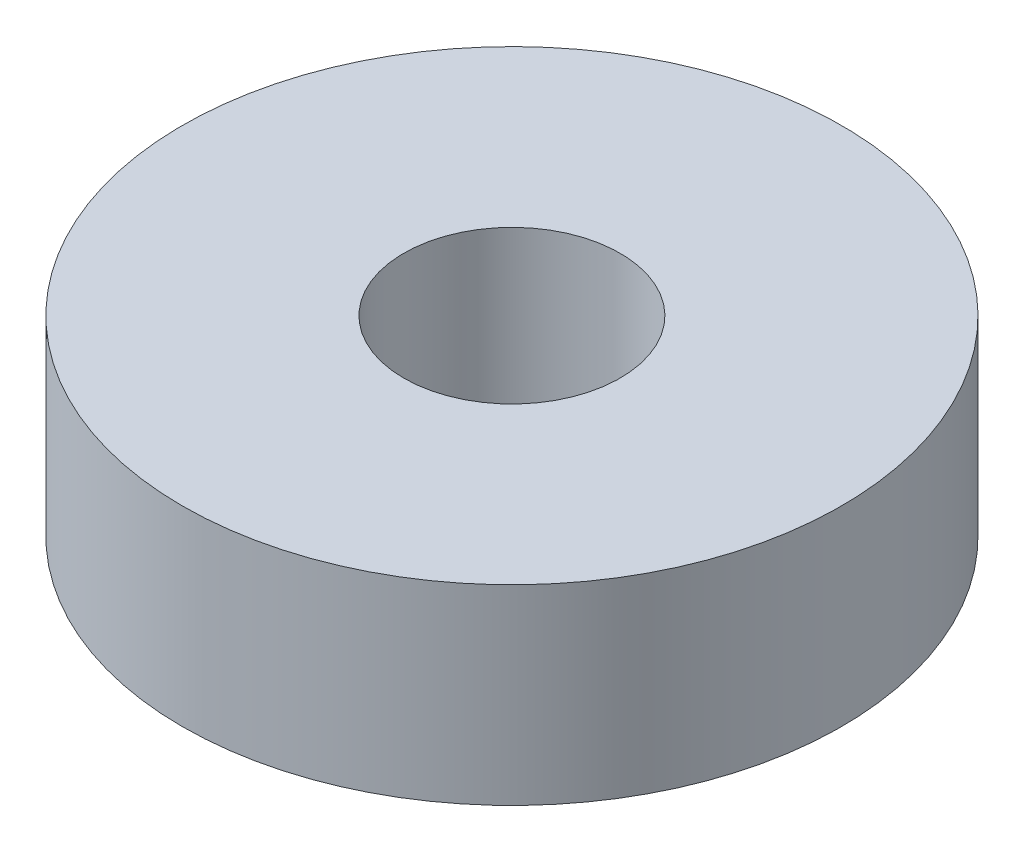
from build123d import *

# Parameters (mm, degrees)
SKETCH1_R           = 15
SKETCH1_R_2         = 4.925
BOSS_EXTRUDE1_DEPTH = 8.7


with BuildPart() as part:
    # Sketch1 → Boss-Extrude1 (new body)
    with BuildSketch(Plane(origin=(0, 0, 0), x_dir=(1, 0, 0), z_dir=(0, 1, 0))):
        with Locations(Location((0, 0, 0), (0, 0, 270))):
            Circle(SKETCH1_R)
        with Locations(Location((0, 0, 0), (0, 0, 270))):
            Circle(SKETCH1_R_2, mode=Mode.SUBTRACT)
    extrude(amount=BOSS_EXTRUDE1_DEPTH)


solid = part.part
